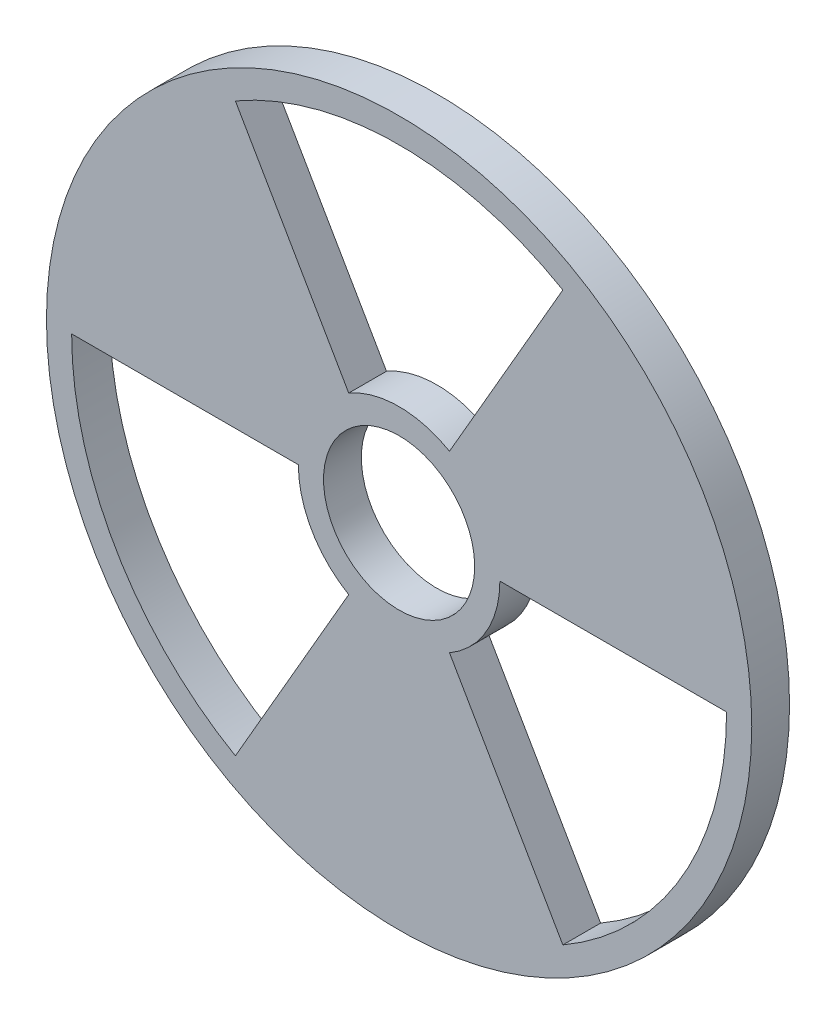
from build123d import *

# Parameters (mm, degrees)
SKETCH_1_R      = 28
SKETCH_1_R_2    = 6
EXTRUDE_1_DEPTH = 3


with BuildPart() as part:
    # 草图1 → 凸台-拉伸1 (new body)
    with BuildSketch(Plane.XY):
        Circle(SKETCH_1_R)
        Circle(SKETCH_1_R_2, mode=Mode.SUBTRACT)
        with BuildLine():
            Line((-13, 22.516660498), (-4, 6.92820323))
            ThreePointArc((-4, 6.92820323), (0, 8), (4, 6.92820323))
            Line((4, 6.92820323), (13, 22.516660498))
            ThreePointArc((13, 22.516660498), (0, 26), (-13, 22.516660498))
        make_face(mode=Mode.SUBTRACT)
        with BuildLine():
            Line((-13, -22.516660498), (-4, -6.92820323))
            ThreePointArc((-4, -6.92820323), (-6.92820323, -4), (-8, 0))
            Line((-8, 0), (-26, 0))
            ThreePointArc((-26, 0), (-22.516660498, -13), (-13, -22.516660498))
        make_face(mode=Mode.SUBTRACT)
        with BuildLine():
            Line((13, -22.516660498), (4, -6.92820323))
            ThreePointArc((4, -6.92820323), (6.92820323, -4), (8, 0))
            Line((8, 0), (26, 0))
            ThreePointArc((26, 0), (22.516660498, -13), (13, -22.516660498))
        make_face(mode=Mode.SUBTRACT)
    extrude(amount=EXTRUDE_1_DEPTH)


solid = part.part
